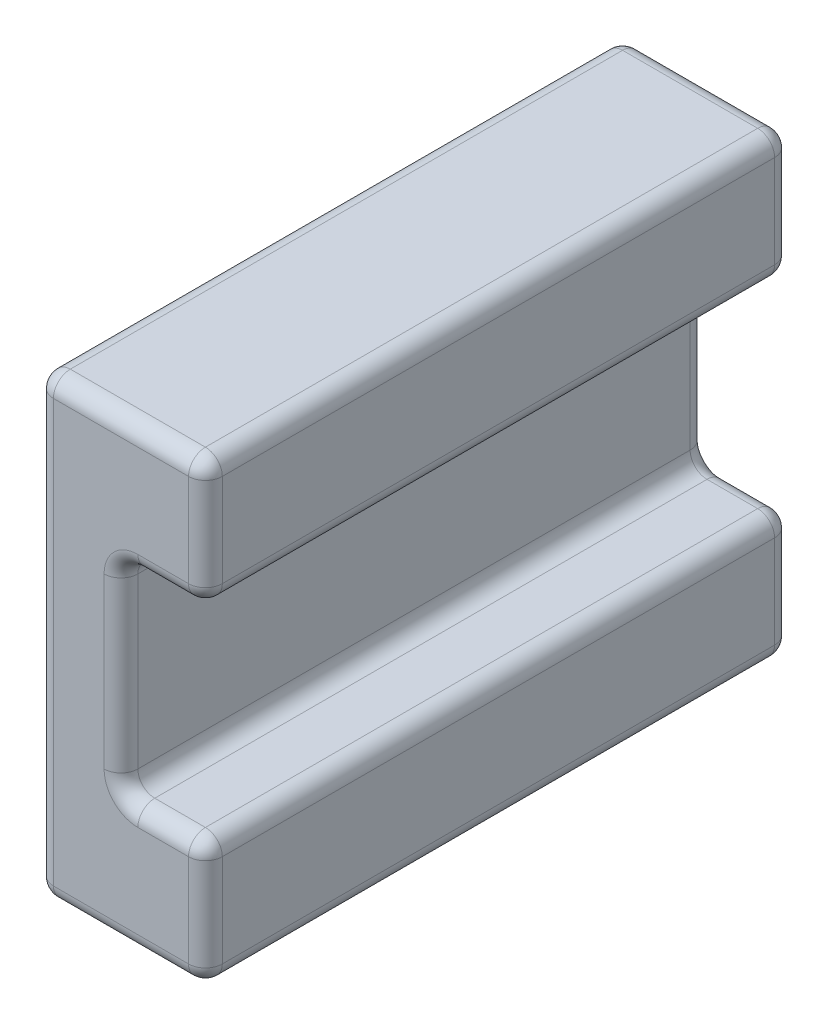
from build123d import *

# Parameters (mm, degrees)
BOSS_EXTRUDE1_DEPTH         = 34.7
FILLET1_R                   = 1
M3_TAPPED_HOLE2_D           = 2.5
M3_TAPPED_HOLE2_DEPTH       = 4.248924226
M3_TAPPED_HOLE2_CSINK_D     = 3.05
M3_TAPPED_HOLE2_CSINK_ANGLE = 90
M3_TAPPED_HOLE2_TIP         = 0.751075774


with BuildPart() as part:
    # Sketch1 → Boss-Extrude1 (new body)
    with BuildSketch(Plane.XY):
        Polygon((5, -6), (5, -13.5), (-5, -13.5), (-5, 13.5), (5, 13.5), (5, 6), (0, 6), (0, -6), align=None)
    extrude(amount=BOSS_EXTRUDE1_DEPTH)

    # Fillet1
    fillet1_edges = [part.edges().sort_by_distance(p)[0] for p in [
        (0, 0, 0),
        (2.5, -6, 0),
        (5, -9.75, 0),
        (0, -13.5, 0),
        (2.5, -6, 34.7),
        (-5, -13.5, 17.35),
        (-5, 13.5, 17.35),
        (5, 13.5, 17.35),
        (5, 6, 17.35),
        (0, 6, 17.35),
        (0, -6, 17.35),
        (5, -6, 17.35),
        (5, -13.5, 17.35),
        (0, 0, 34.7),
        (2.5, 6, 34.7),
        (5, 9.75, 34.7),
        (0, 13.5, 34.7),
        (-5, 0, 34.7),
        (0, -13.5, 34.7),
        (-5, 0, 0),
        (5, -9.75, 34.7),
        (0, 13.5, 0),
        (5, 9.75, 0),
        (2.5, 6, 0),
    ]]
    fillet(fillet1_edges, radius=FILLET1_R)

    # M3 Tapped Hole2
    with Locations(Plane(origin=(-5, 10, 9.85), x_dir=(0, -1, 0), z_dir=(-1, 0, 0))):
        with Locations((0, 0), (0, 15), (20, 15), (20, 0)):
            CounterSinkHole(M3_TAPPED_HOLE2_D / 2, M3_TAPPED_HOLE2_CSINK_D / 2, depth=M3_TAPPED_HOLE2_DEPTH, counter_sink_angle=M3_TAPPED_HOLE2_CSINK_ANGLE)
            with Locations((0, 0, -(M3_TAPPED_HOLE2_DEPTH + M3_TAPPED_HOLE2_TIP / 2))):  # 118° drill point
                Cone(0, M3_TAPPED_HOLE2_D / 2, M3_TAPPED_HOLE2_TIP, mode=Mode.SUBTRACT)


solid = part.part
